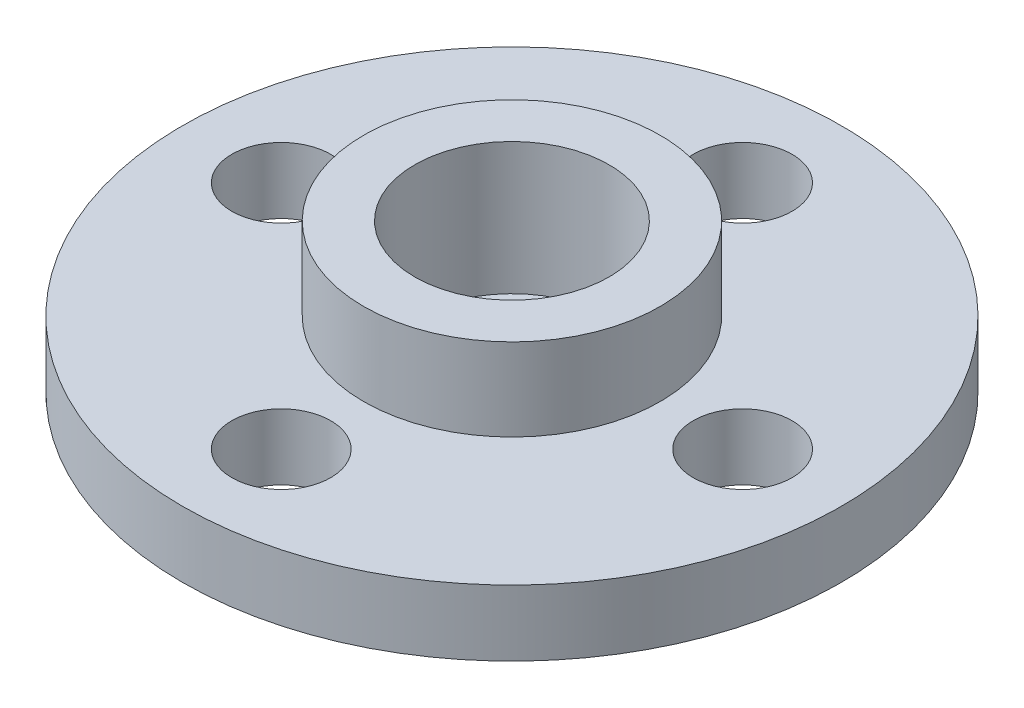
from build123d import *

# Parameters (mm, degrees)
SKETCH_1_R            = 10
EXTRUDE_1_DEPTH       = 2
SKETCH_2_R            = 4.5
EXTRUDE_2_DEPTH       = 2.5
SKETCH_3_R            = 2.95
CUT_EXTRUDE_1_DEPTH   = 4
HOLE_WIZARD_3_0_3_1_D = 3


with BuildPart() as part:
    # 草图1 → 凸台-拉伸1 (new body)
    with BuildSketch(Plane(origin=(0, 0, 0), x_dir=(1, 0, 0), z_dir=(0, 1, 0))):
        with Locations(Location((0, 0, 0), (0, 0, 270))):
            Circle(SKETCH_1_R)
    extrude(amount=EXTRUDE_1_DEPTH)

    # 草图2 → 凸台-拉伸2 (add)
    with BuildSketch(Plane(origin=(0, 2, 0), x_dir=(1, 0, 0), z_dir=(0, 1, 0))):
        with Locations(Location((0, 0, 0), (0, 0, 270))):
            Circle(SKETCH_2_R)
    extrude(amount=EXTRUDE_2_DEPTH)

    # 草图3 → 切除-拉伸1 (cut)
    with BuildSketch(Plane(origin=(0, 4.5, 0), x_dir=(1, 0, 0), z_dir=(0, 1, 0))):
        with Locations(Location((0, 0, 0), (0, 0, 270))):
            Circle(SKETCH_3_R)
    extrude(amount=-CUT_EXTRUDE_1_DEPTH, mode=Mode.SUBTRACT)

    # Ø3.0 (3) 直径孔1 (through all)
    with Locations(Plane(origin=(0, 2, 0), x_dir=(1, 0, 0), z_dir=(0, 1, 0))):
        with Locations((0, 7), (7, 0), (0, -7), (-7, 0), (0, 0)):
            Hole(HOLE_WIZARD_3_0_3_1_D / 2)


solid = part.part
